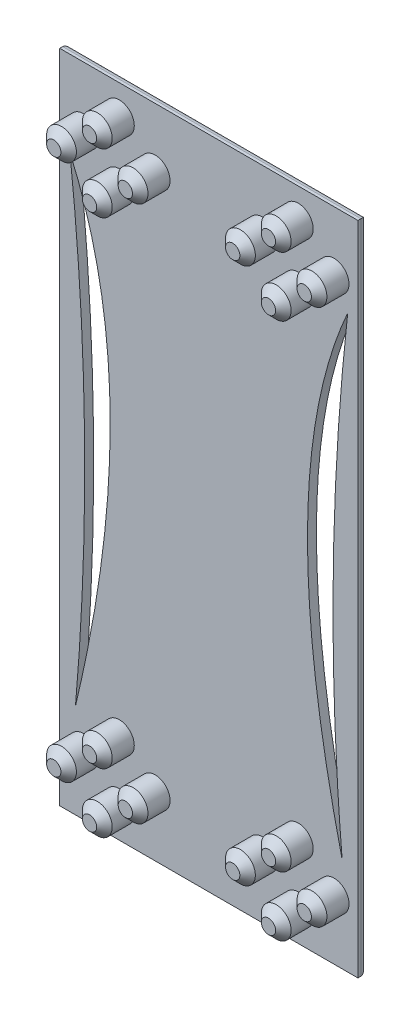
from build123d import *

# Parameters (mm, degrees)
CROQUIS1_W              = 50
CROQUIS1_H              = 110
SALIENTE_EXTRUIR1_DEPTH = 1.5
CROQUIS2_R              = 2.5
SALIENTE_EXTRUIR2_DEPTH = 5
CHAFL_N1_SIZE           = 1.3
REDONDEO1_R             = 1
CORTAR_EXTRUIR1_DEPTH   = 10


with BuildPart() as part:
    # Croquis1 → Saliente-Extruir1 (new body)
    with BuildSketch(Plane.XY):
        Rectangle(CROQUIS1_W, CROQUIS1_H)
    extrude(amount=SALIENTE_EXTRUIR1_DEPTH)

    # Croquis2 → Saliente-Extruir2 (add)
    with BuildSketch(Plane.XY.offset(1.5)):
        with Locations((-15, 50)):
            Circle(CROQUIS2_R)
        with Locations((-21, 45)):
            Circle(CROQUIS2_R)
        with Locations((-15, 40)):
            Circle(CROQUIS2_R)
        with Locations((-9, 45)):
            Circle(CROQUIS2_R)
        with Locations((-15, -40)):
            Circle(CROQUIS2_R)
        with Locations((-9, -45)):
            Circle(CROQUIS2_R)
        with Locations((-15, -50)):
            Circle(CROQUIS2_R)
        with Locations((-21, -45)):
            Circle(CROQUIS2_R)
        with Locations((21, -45)):
            Circle(CROQUIS2_R)
        with Locations((15, -50)):
            Circle(CROQUIS2_R)
        with Locations((9, -45)):
            Circle(CROQUIS2_R)
        with Locations((15, -40)):
            Circle(CROQUIS2_R)
        with Locations((21, 45)):
            Circle(CROQUIS2_R)
        with Locations((15, 50)):
            Circle(CROQUIS2_R)
        with Locations((9, 45)):
            Circle(CROQUIS2_R)
        with Locations((15, 40)):
            Circle(CROQUIS2_R)
    extrude(amount=SALIENTE_EXTRUIR2_DEPTH)

    # Chaflán1
    chafl_n1_edges = [part.edges().sort_by_distance(p)[0] for p in [
        (-23.5, 45, 6.5),
        (-17.5, 40, 6.5),
        (-17.5, 50, 6.5),
        (-11.5, 45, 6.5),
        (6.5, 45, 6.5),
        (12.5, 40, 6.5),
        (12.5, 50, 6.5),
        (18.5, 45, 6.5),
        (18.5, -45, 6.5),
        (12.5, -50, 6.5),
        (12.5, -40, 6.5),
        (6.5, -45, 6.5),
        (-11.5, -45, 6.5),
        (-17.5, -50, 6.5),
        (-17.5, -40, 6.5),
        (-23.5, -45, 6.5),
    ]]
    chamfer(chafl_n1_edges, length=CHAFL_N1_SIZE)

    # Redondeo1
    redondeo1_edges = [part.edges().sort_by_distance(p)[0] for p in [
        (0, 55, 0),
        (-25, 0, 0),
        (0, -55, 0),
        (25, 0, 0),
    ]]
    fillet(redondeo1_edges, radius=REDONDEO1_R)

    # Croquis3 → Cortar-Extruir1 (cut)
    with BuildSketch(Plane(origin=(0, 0, 0), x_dir=(-1, 0, 0), z_dir=(0, 0, -1))):
        with BuildLine():
            add(Edge.make_bspline(
                [(22.361475253, -39.186991388), (10.271319675, 11.528482347), (23.288602916, 40.714890738)],
                knots=[0, 0, 0, 1, 1, 1], degree=2))
            add(Edge.make_bspline(
                [(22.361475253, -39.186991388), (20.200722134, -14.449114626), (20.113642926, 12.226208442), (23.288602916, 40.714890738)],
                knots=[0, 0, 0, 0, 1, 1, 1, 1], degree=3))
        make_face()
        with BuildLine():
            add(Edge.make_bspline(
                [(-22.361475253, -39.186991388), (-20.200722134, -14.449114626), (-20.113642926, 12.226208442), (-23.288602916, 40.714890738)],
                knots=[0, 0, 0, 0, 1, 1, 1, 1], degree=3))
            add(Edge.make_bspline(
                [(-22.361475253, -39.186991388), (-10.271319675, 11.528482347), (-23.288602916, 40.714890738)],
                knots=[0, 0, 0, 1, 1, 1], degree=2))
        make_face()
    extrude(amount=-CORTAR_EXTRUIR1_DEPTH, mode=Mode.SUBTRACT)


solid = part.part
